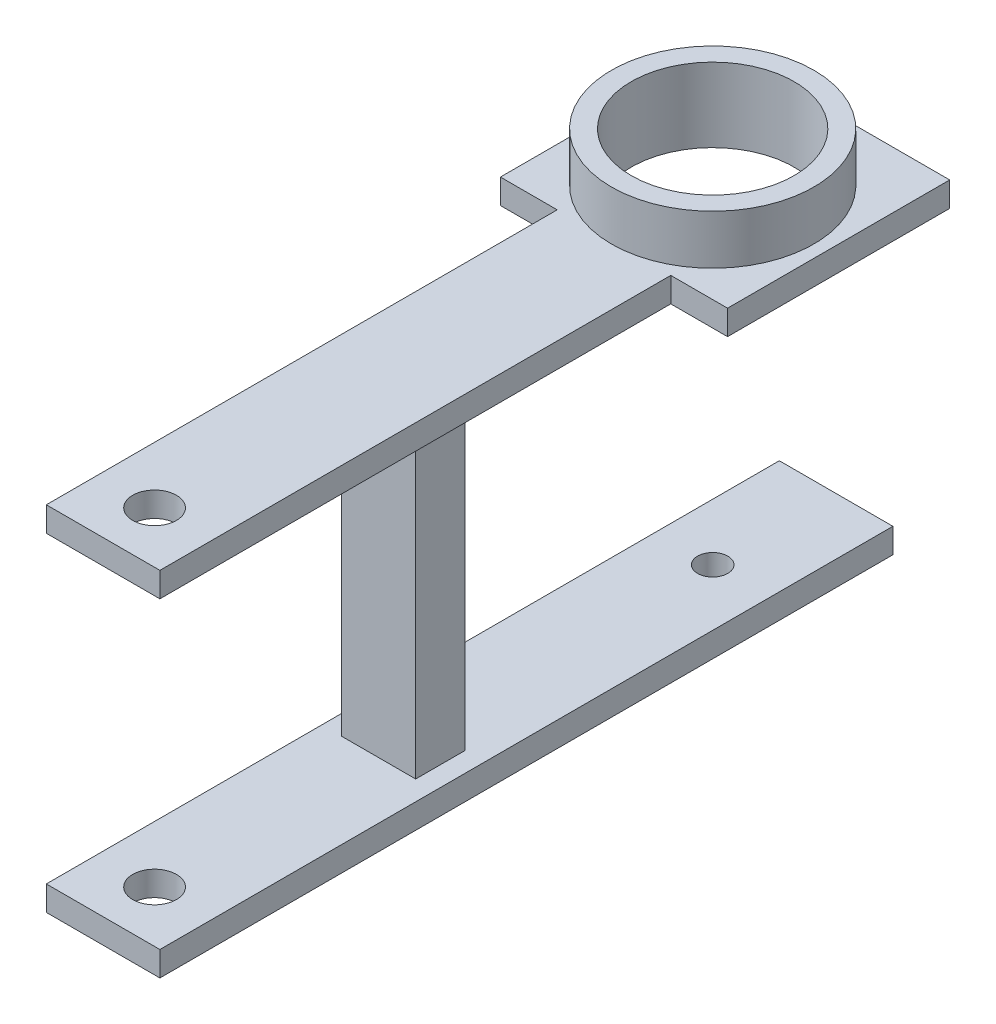
from build123d import *

# Parameters (mm, degrees)
SKETCH1_W           = 46
SKETCH1_H           = 160
SKETCH1_R           = 3.05
SKETCH1_R_2         = 4.425
BOSS_EXTRUDE2_DEPTH = 5
SKETCH4_W           = 46
SKETCH4_H           = 160
BOSS_EXTRUDE3_DEPTH = 5
SKETCH5_R           = 16.5
CUT_EXTRUDE2_DEPTH  = 5
SKETCH5_6_R         = 20.5
SKETCH5_6_R_2       = 16.5
BOSS_EXTRUDE5_DEPTH = 10
BOSS_EXTRUDE7_DEPTH = 61.5
SKETCH8_W           = 11.5
SKETCH8_H           = 67.35
SKETCH8_H_2         = 92.65
CUT_EXTRUDE3_DEPTH  = 10
SKETCH10_W          = 11.5
SKETCH10_H          = 115.012630191
CUT_EXTRUDE5_DEPTH  = 10
SKETCH11_R          = 4.425
CUT_EXTRUDE6_DEPTH  = 10
SKETCH12_W          = 11.5
SKETCH12_H          = 11.545
CUT_EXTRUDE7_DEPTH  = 10
SKETCH13_W          = 11.5
SKETCH13_H          = 11.545
CUT_EXTRUDE8_DEPTH  = 10


with BuildPart() as part:
    # Sketch1 → Boss-Extrude2 (new body)
    with BuildSketch(Plane(origin=(0, 0, 0), x_dir=(1, 0, 0), z_dir=(0, 1, 0))):
        with Locations((0, -55)):
            Rectangle(SKETCH1_W, SKETCH1_H)
        with Locations(Location((0, 0, 0), (0, 0, 270))):
            Circle(SKETCH1_R, mode=Mode.SUBTRACT)
        with Locations(Location((0, -113.03, 0), (0, 0, 270))):
            Circle(SKETCH1_R_2, mode=Mode.SUBTRACT)
    extrude(amount=BOSS_EXTRUDE2_DEPTH)



with BuildPart() as body_2:
    # Sketch4 → Boss-Extrude3 (new body)
    with BuildSketch(Plane(origin=(0, 71.5, 0), x_dir=(1, 0, 0), z_dir=(0, 1, 0))):
        with Locations((0, -55)):
            Rectangle(SKETCH4_W, SKETCH4_H)
    extrude(amount=-BOSS_EXTRUDE3_DEPTH)

    # Sketch5 → Cut-Extrude2 (cut)
    with BuildSketch(Plane(origin=(0, 71.5, 0), x_dir=(1, 0, 0), z_dir=(0, 1, 0))):
        with Locations(Location((0, 0, 0), (0, 0, 270))):
            Circle(SKETCH5_R)
    extrude(amount=-CUT_EXTRUDE2_DEPTH, mode=Mode.SUBTRACT)

    # Sketch5<6> → Boss-Extrude5 (add)
    with BuildSketch(Plane(origin=(0, 71.5, 0), x_dir=(1, 0, 0), z_dir=(0, 1, 0))):
        with Locations(Location((0, 0, 0), (0, 0, 90))):
            Circle(SKETCH5_6_R)
        with Locations(Location((0, 0, 0), (0, 0, 270))):
            Circle(SKETCH5_6_R_2, mode=Mode.SUBTRACT)
    extrude(amount=BOSS_EXTRUDE5_DEPTH)


with BuildPart() as part_1:
    add(part.part)

    add(body_2.part)  # Boss-Extrude7 merges body 2
    # Sketch7 → Boss-Extrude7 (add)
    with BuildSketch(Plane(origin=(0, 5, 0), x_dir=(1, 0, 0), z_dir=(0, 1, 0))):
        with BuildLine():
            Line((7.5, -57.65), (-7.5, -57.65))
            Line((-7.5, -57.65), (-7.5, -62.65))
            Line((-7.5, -62.65), (-3, -62.65))
            ThreePointArc((-3, -62.65), (0, -59.65), (3, -62.65))
            Line((3, -62.65), (7.5, -62.65))
            Line((7.5, -62.65), (7.5, -57.65))
        make_face()
        with BuildLine():
            Line((-3, -62.65), (-7.5, -62.65))
            Line((-7.5, -62.65), (-7.5, -67.65))
            Line((-7.5, -67.65), (7.5, -67.65))
            Line((7.5, -67.65), (7.5, -62.65))
            Line((7.5, -62.65), (3, -62.65))
            ThreePointArc((3, -62.65), (0, -65.65), (-3, -62.65))
        make_face()
        with BuildLine():
            ThreePointArc((3, -62.65), (0, -59.65), (-3, -62.65))
            Line((-3, -62.65), (3, -62.65))
        make_face()
        with BuildLine():
            Line((3, -62.65), (-3, -62.65))
            ThreePointArc((-3, -62.65), (0, -65.65), (3, -62.65))
        make_face()
    extrude(amount=BOSS_EXTRUDE7_DEPTH)

    # Sketch8 → Cut-Extrude3 (cut)
    with BuildSketch(Plane(origin=(0, 5, 0), x_dir=(1, 0, 0), z_dir=(0, 1, 0))):
        with Locations((-17.25, -101.325)):
            Rectangle(SKETCH8_W, SKETCH8_H)
        with Locations((-17.25, -21.325)):
            Rectangle(SKETCH8_W, SKETCH8_H_2)
        with Locations((17.25, -101.325)):
            Rectangle(SKETCH8_W, SKETCH8_H)
        with Locations((17.25, -21.325)):
            Rectangle(SKETCH8_W, SKETCH8_H_2)
    extrude(amount=-CUT_EXTRUDE3_DEPTH, mode=Mode.SUBTRACT)

    # Sketch10 → Cut-Extrude5 (cut)
    with BuildSketch(Plane.XZ.offset(-66.5)):
        with Locations((-17.25, 77.493684905)):
            Rectangle(SKETCH10_W, SKETCH10_H)
        with Locations((17.25, 77.493684905)):
            Rectangle(SKETCH10_W, SKETCH10_H)
    extrude(amount=-CUT_EXTRUDE5_DEPTH, mode=Mode.SUBTRACT)

    # Sketch11 → Cut-Extrude6 (cut)
    with BuildSketch(Plane.XZ.offset(-66.5)):
        with Locations(Location((0, 113.03, 0), (0, 0, 90))):
            Circle(SKETCH11_R)
    extrude(amount=-CUT_EXTRUDE6_DEPTH, mode=Mode.SUBTRACT)

    # Sketch12 → Cut-Extrude7 (cut)
    with BuildSketch(Plane(origin=(0, 5, 0), x_dir=(1, 0, 0), z_dir=(0, 1, 0))):
        with Locations((-5.75, -129.2275)):
            Rectangle(SKETCH12_W, SKETCH12_H)
        with Locations((5.75, -129.2275)):
            Rectangle(SKETCH12_W, SKETCH12_H)
    extrude(amount=-CUT_EXTRUDE7_DEPTH, mode=Mode.SUBTRACT)

    # Sketch13 → Cut-Extrude8 (cut)
    with BuildSketch(Plane(origin=(0, 71.5, 0), x_dir=(1, 0, 0), z_dir=(0, 1, 0))):
        with Locations((-5.75, -129.2275)):
            Rectangle(SKETCH13_W, SKETCH13_H)
        with Locations((5.75, -129.2275)):
            Rectangle(SKETCH13_W, SKETCH13_H)
    extrude(amount=-CUT_EXTRUDE8_DEPTH, mode=Mode.SUBTRACT)


solid = part_1.part
